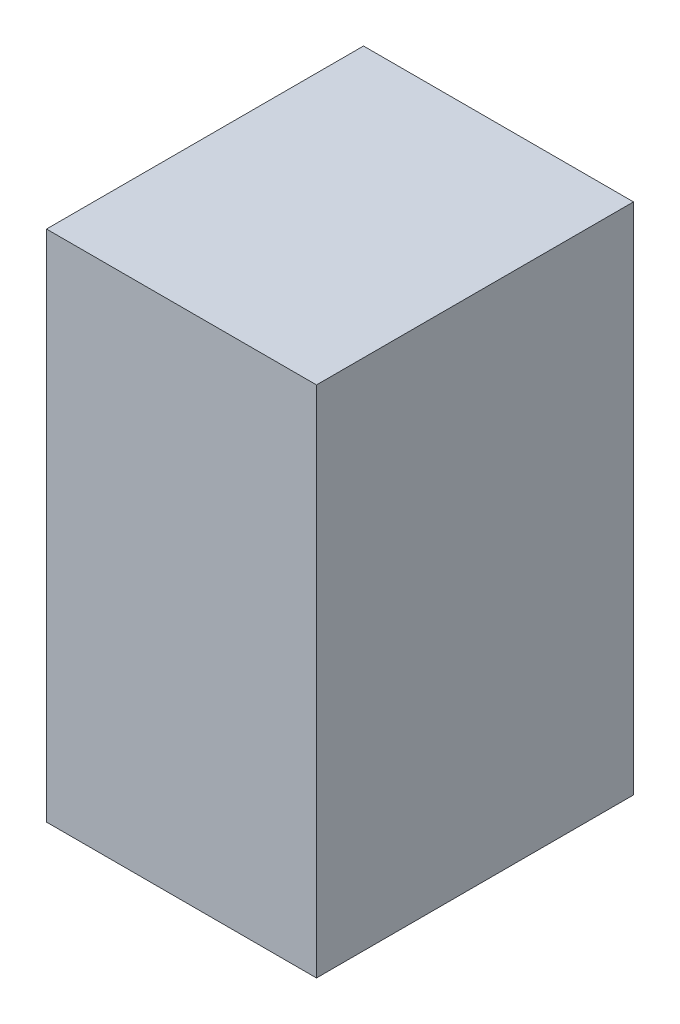
from build123d import *

# Parameters (mm, degrees)
SKETCH1_W           = 66.58357333
SKETCH1_H           = 41.094549164
BOSS_EXTRUDE1_DEPTH = 35


with BuildPart() as part:
    # Sketch1 → Boss-Extrude1 (new body)
    with BuildSketch(Plane.YZ):
        Rectangle(SKETCH1_W, SKETCH1_H)
    extrude(amount=BOSS_EXTRUDE1_DEPTH)


solid = part.part
